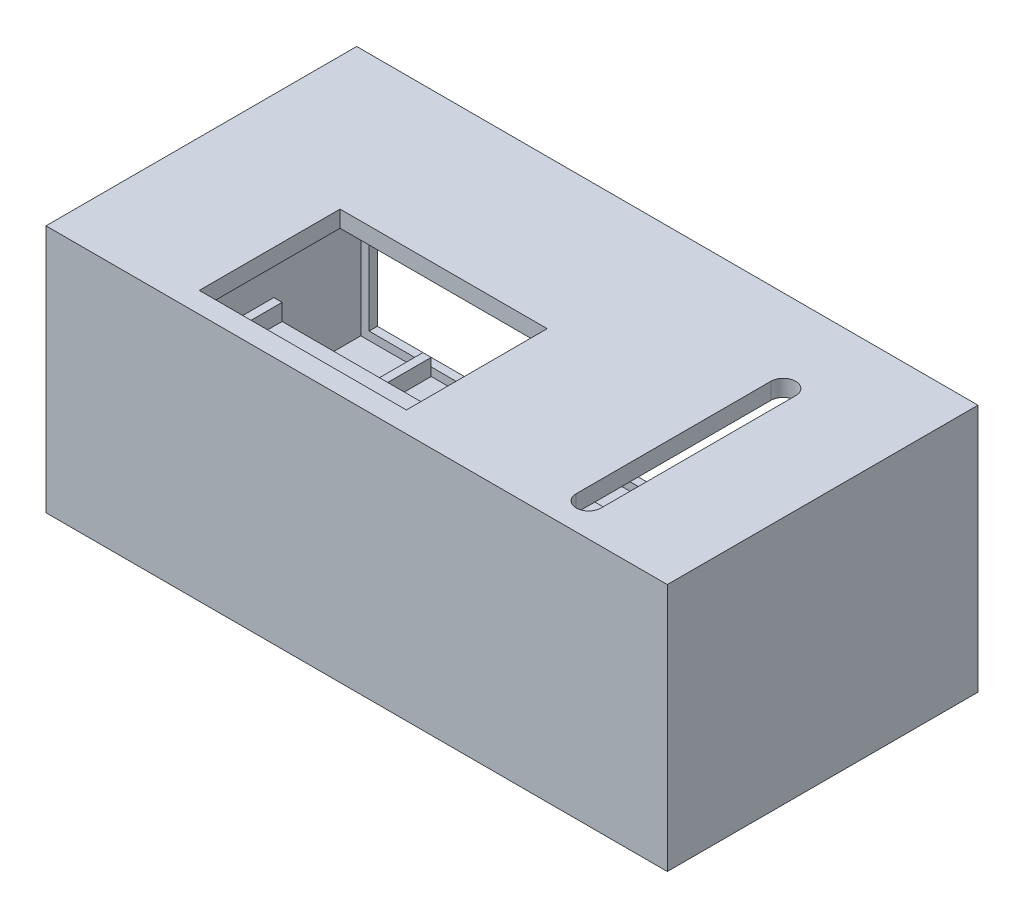
from build123d import *

# Parameters (mm, degrees)
ESQUISSE1_W                 = 150
ESQUISSE1_H                 = 60
BOSS_EXTRU_1_DEPTH          = 37.5
ESQUISSE3_W                 = 140
ESQUISSE3_H                 = 52
ENL_V_MAT_EXTRU_2_DEPTH     = 70
ENL_V_MAT_VENTILATEUR_REACH = 159.5
ESQUISSE6_W                 = 30
ESQUISSE6_H                 = 30
ESQUISSE7_W                 = 2
ESQUISSE7_H                 = 4
BOSS_EXTRU_2_DEPTH          = 66
BOSS_EXTRU_3_DEPTH          = 30
ENL_V_MAT_ECRAN_REACH       = 105.108
ESQUISSE11_W                = 50
ESQUISSE11_H                = 34
ENL_V_MAT_MOLETTE_DEPTH     = 4
ESQUISSE15_W                = 2
ESQUISSE15_H                = 56
ENL_V_MAT_PAROI_DEPTH       = 147
BOSS_MOLETTE_DEPTH          = 2


with BuildPart() as part:
    # Esquisse1 → Boss.-Extru.1 (new, symmetric)
    with BuildSketch(Plane.XY):
        Rectangle(ESQUISSE1_W, ESQUISSE1_H)
    extrude(amount=BOSS_EXTRU_1_DEPTH, both=True)

    # Esquisse3 → Enlèv. mat.-Extru.2 (cut)
    with BuildSketch(Plane(origin=(0, 0, -37.5), x_dir=(-1, 0, 0), z_dir=(0, 0, -1))):
        Rectangle(ESQUISSE3_W, ESQUISSE3_H)
    extrude(amount=-ENL_V_MAT_EXTRU_2_DEPTH, mode=Mode.SUBTRACT)

    # Esquisse6 → Enlèv. mat.-Ventilateur (cut, up to next)
    with BuildSketch(Plane.ZY.offset(75), mode=Mode.PRIVATE) as enl_v_mat_ventilateur_sk1:
        with Locations((17.5, 10)):
            Rectangle(ESQUISSE6_W, ESQUISSE6_H)
    enl_v_mat_ventilateur_tool1 = extrude(enl_v_mat_ventilateur_sk1.sketch, amount=-ENL_V_MAT_VENTILATEUR_REACH, mode=Mode.PRIVATE) & part.part
    add(enl_v_mat_ventilateur_tool1.solids().sort_by_distance((-75, 10, 17.5))[0], mode=Mode.SUBTRACT)

    # Esquisse7 → Boss.-Extru.2 (add)
    with BuildSketch(Plane(origin=(0, 0, 32.5), x_dir=(-1, 0, 0), z_dir=(0, 0, -1))):
        with Locations((54, -24)):
            Rectangle(ESQUISSE7_W, ESQUISSE7_H)
    extrude(amount=BOSS_EXTRU_2_DEPTH)

    # Esquisse9 → Boss.-Extru.3 (add)
    with BuildSketch(Plane(origin=(0, 0, 32.5), x_dir=(-1, 0, 0), z_dir=(0, 0, -1))):
        Polygon((-70, 3.5), (53, 3.5), (53, 7.5), (55, 7.5), (55, 0), (-70, 0), align=None)
    extrude(amount=BOSS_EXTRU_3_DEPTH)

    # Esquisse11 → Enlèv. mat.-ecran (cut, up to next)
    with BuildSketch(Plane(origin=(0, 30, 0), x_dir=(1, 0, 0), z_dir=(0, 1, 0)), mode=Mode.PRIVATE) as enl_v_mat_ecran_sk1:
        with Locations((-18, -15.5)):
            Rectangle(ESQUISSE11_W, ESQUISSE11_H)
    enl_v_mat_ecran_tool1 = extrude(enl_v_mat_ecran_sk1.sketch, amount=-ENL_V_MAT_ECRAN_REACH, mode=Mode.PRIVATE) & part.part
    add(enl_v_mat_ecran_tool1.solids().sort_by_distance((-18, 30, 15.5))[0], mode=Mode.SUBTRACT)

    # Esquisse14 → Enlèv. mat.-molette (cut)
    with BuildSketch(Plane(origin=(0, 30, 0), x_dir=(1, 0, 0), z_dir=(0, 1, 0))):
        with BuildLine():
            Line((51, 17.5), (51, -29.5))
            ThreePointArc((51, -29.5), (48, -32.5), (45, -29.5))
            Line((45, -29.5), (45, 17.5))
            ThreePointArc((45, 17.5), (48, 20.5), (51, 17.5))
        make_face()
    extrude(amount=-ENL_V_MAT_MOLETTE_DEPTH, mode=Mode.SUBTRACT)

    # Esquisse15 → Enlèv. mat.-paroi (cut)
    with BuildSketch(Plane.ZY.offset(75)):
        with Locations((-34.5, 0)):
            Rectangle(ESQUISSE15_W, ESQUISSE15_H)
    extrude(amount=-ENL_V_MAT_PAROI_DEPTH, mode=Mode.SUBTRACT)

    # Esquisse16 → Boss.-molette (add)
    with BuildSketch(Plane(origin=(0, 3.5, 0), x_dir=(1, 0, 0), z_dir=(0, 1, 0))):
        Polygon((64, -32.5), (64, -12.5), (32, -12.5), (32, -32.5), (30, -32.5), (30, -10.5), (66, -10.5), (66, -32.5), align=None)
    extrude(amount=BOSS_MOLETTE_DEPTH)


solid = part.part
